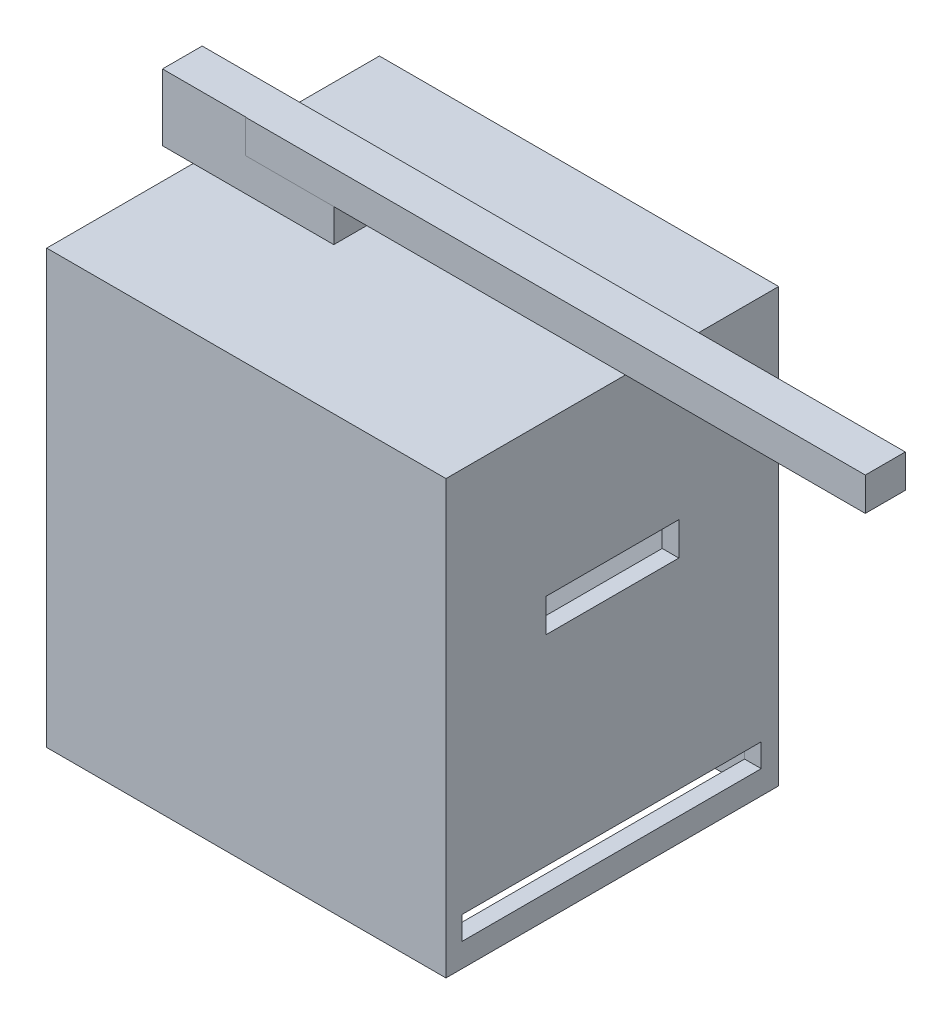
from build123d import *

# Parameters (mm, degrees)
SKETCH1_W               = 60
SKETCH1_H               = 50
SKETCH1_W_2             = 55
SKETCH1_H_2             = 45
BOSS_EXTRUDE1_DEPTH     = 50
SKETCH2_W               = 60
SKETCH2_H               = 50
BOSS_EXTRUDE2_DEPTH     = 5
CUT_EXTRUDE1_REACH      = 87.147
SKETCH3_W               = 20
SKETCH3_H               = 5
SKETCH4_W               = 25.74299971
SKETCH4_H               = 5.966870814
BOSS_EXTRUDE5_DEPTH     = 10
SKETCH8_W               = 93.117720322
SKETCH8_H               = 6.00994507
BOSS_EXTRUDE6_DEPTH     = 5
SKETCH10_W              = 60
SKETCH10_H              = 50
SKETCH10_W_2            = 55
SKETCH10_H_2            = 45
BOSS_EXTRUDE7_DEPTH     = 10
CUT_EXTRUDE2_DEPTH      = 123.723278076
CUT_EXTRUDE2_DEPTH_BACK = 123.723278076
SKETCH11_W              = 45
SKETCH11_H              = 3.5


with BuildPart() as part:
    # Sketch1 → Boss-Extrude1 (new body)
    with BuildSketch(Plane(origin=(0, 0, 0), x_dir=(1, 0, 0), z_dir=(0, 1, 0))):
        Rectangle(SKETCH1_W, SKETCH1_H)
        Rectangle(SKETCH1_W_2, SKETCH1_H_2, mode=Mode.SUBTRACT)
    extrude(amount=BOSS_EXTRUDE1_DEPTH)

    # Sketch2 → Boss-Extrude2 (add)
    with BuildSketch(Plane(origin=(0, 50, 0), x_dir=(1, 0, 0), z_dir=(0, 1, 0))):
        Rectangle(SKETCH2_W, SKETCH2_H)
    extrude(amount=BOSS_EXTRUDE2_DEPTH)

    # Sketch3 → Cut-Extrude1 (cut, up to next)
    with BuildSketch(Plane(origin=(30, 0, 0), x_dir=(0, 0, -1), z_dir=(1, 0, 0)), mode=Mode.PRIVATE) as cut_extrude1_sk1:
        with Locations((0, 29.65624639)):
            Rectangle(SKETCH3_W, SKETCH3_H)
    cut_extrude1_tool1 = extrude(cut_extrude1_sk1.sketch, amount=-CUT_EXTRUDE1_REACH, mode=Mode.PRIVATE) & part.part
    add(cut_extrude1_tool1.solids().sort_by_distance((30, 29.656246, 0))[0], mode=Mode.SUBTRACT)

    # Sketch4 → Boss-Extrude5 (add)
    with BuildSketch(Plane(origin=(0, 55, 0), x_dir=(1, 0, 0), z_dir=(0, 1, 0))):
        with Locations((-21.74634114, 0)):
            Rectangle(SKETCH4_W, SKETCH4_H)
    extrude(amount=BOSS_EXTRUDE5_DEPTH)

    # Sketch8 → Boss-Extrude6 (add)
    with BuildSketch(Plane(origin=(0, 65, 0), x_dir=(1, 0, 0), z_dir=(0, 1, 0))):
        with Locations((24.490647417, -0.021537128)):
            Rectangle(SKETCH8_W, SKETCH8_H)
    extrude(amount=-BOSS_EXTRUDE6_DEPTH)

    # Sketch10 → Boss-Extrude7 (add)
    with BuildSketch(Plane.XZ):
        Rectangle(SKETCH10_W, SKETCH10_H)
        Rectangle(SKETCH10_W_2, SKETCH10_H_2, mode=Mode.SUBTRACT)
    extrude(amount=BOSS_EXTRUDE7_DEPTH)

    # Sketch11 → Cut-Extrude2 (cut, two sides: drawn at the far end of the back side and taken through both)
    with BuildSketch(Plane.ZY.offset(30).offset(-CUT_EXTRUDE2_DEPTH_BACK)):
        with Locations((0.11957715, -4.695440094)):
            Rectangle(SKETCH11_W, SKETCH11_H)
    extrude(amount=CUT_EXTRUDE2_DEPTH + CUT_EXTRUDE2_DEPTH_BACK, mode=Mode.SUBTRACT)


solid = part.part
